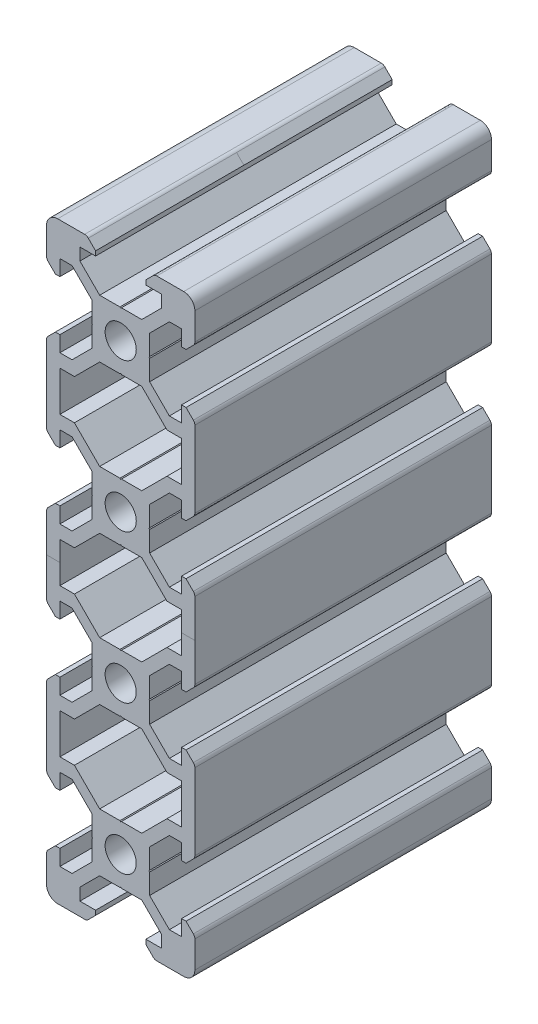
from build123d import *

# Parameters (mm, degrees)
SKETCH1_R           = 2.1
BOSS_EXTRUDE2_DEPTH = 40


with BuildPart() as part:
    # Sketch1 → Boss-Extrude2 (new body)
    with BuildSketch(Plane.XY):
        with BuildLine():
            Line((-8.5, 10), (-4.862792737, 10))
            ThreePointArc((-4.862792737, 10), (-4.598292737, 9.947387679), (-4.374060464, 9.797560464))
            Line((-4.374060464, 9.797560464), (-3.3865, 8.81))
            Line((-3.3865, 8.81), (-3.3865, 8.2))
            Line((-3.3865, 8.2), (-5.5, 8.2))
            Line((-5.5, 8.2), (-5.5, 6.561))
            Line((-5.5, 6.561), (-2.8395, 3.9005))
            Line((-2.8395, 3.9005), (-0.1, 3.9005))
            Line((-0.1, 3.9005), (0, 3.8005))
            Line((0, 3.8005), (0.1, 3.9005))
            Line((0.1, 3.9005), (2.8395, 3.9005))
            Line((2.8395, 3.9005), (5.5, 6.561))
            Line((5.5, 6.561), (5.5, 8.2))
            Line((5.5, 8.2), (3.3865, 8.2))
            Line((3.3865, 8.2), (3.3865, 8.81))
            Line((3.3865, 8.81), (4.374060464, 9.797560464))
            ThreePointArc((4.374060464, 9.797560464), (4.598292737, 9.947387679), (4.862792737, 10))
            Line((4.862792737, 10), (8.5, 10))
            ThreePointArc((8.5, 10), (9.560660172, 9.560660172), (10, 8.5))
            Line((10, 8.5), (10, 4.862792737))
            ThreePointArc((10, 4.862792737), (9.947387679, 4.598292737), (9.797560464, 4.374060464))
            Line((9.797560464, 4.374060464), (8.81, 3.3865))
            Line((8.81, 3.3865), (8.2, 3.3865))
            Line((8.2, 3.3865), (8.2, 5.5))
            Line((8.2, 5.5), (6.561, 5.5))
            Line((6.561, 5.5), (3.9005, 2.8395))
            Line((3.9005, 2.8395), (3.9005, 0.1))
            Line((3.9005, 0.1), (3.8005, 0))
            Line((3.8005, 0), (3.9005, -0.1))
            Line((3.9005, -0.1), (3.9005, -2.8395))
            Line((3.9005, -2.8395), (6.561, -5.5))
            Line((6.561, -5.5), (8.2, -5.5))
            Line((8.2, -5.5), (8.2, -3.3865))
            Line((8.2, -3.3865), (8.81, -3.3865))
            Line((8.81, -3.3865), (9.797560464, -4.374060464))
            ThreePointArc((9.797560464, -4.374060464), (9.947387679, -4.598292737), (10, -4.862792737))
            Line((10, -4.862792737), (10, -15.137207263))
            ThreePointArc((10, -15.137207263), (9.947387679, -15.401707263), (9.797560464, -15.625939536))
            Line((9.797560464, -15.625939536), (8.81, -16.6135))
            Line((8.81, -16.6135), (8.2, -16.6135))
            Line((8.2, -16.6135), (8.2, -14.5))
            Line((8.2, -14.5), (6.561, -14.5))
            Line((6.561, -14.5), (3.9005, -17.1605))
            Line((3.9005, -17.1605), (3.9005, -19.9))
            Line((3.9005, -19.9), (3.8005, -20))
            Line((3.8005, -20), (3.9005, -20.1))
            Line((3.9005, -20.1), (3.9005, -22.8395))
            Line((3.9005, -22.8395), (6.561, -25.5))
            Line((6.561, -25.5), (8.2, -25.5))
            Line((8.2, -25.5), (8.2, -23.3865))
            Line((8.2, -23.3865), (8.81, -23.3865))
            Line((8.81, -23.3865), (9.797560464, -24.374060464))
            ThreePointArc((9.797560464, -24.374060464), (9.947387679, -24.598292737), (10, -24.862792737))
            Line((10, -24.862792737), (10, -35.137207263))
            ThreePointArc((10, -35.137207263), (9.947387679, -35.401707263), (9.797560464, -35.625939536))
            Line((9.797560464, -35.625939536), (8.81, -36.6135))
            Line((8.81, -36.6135), (8.2, -36.6135))
            Line((8.2, -36.6135), (8.2, -34.5))
            Line((8.2, -34.5), (6.561, -34.5))
            Line((6.561, -34.5), (3.9005, -37.1605))
            Line((3.9005, -37.1605), (3.9005, -39.9))
            Line((3.9005, -39.9), (3.8005, -40))
            Line((3.8005, -40), (3.9005, -40.1))
            Line((3.9005, -40.1), (3.9005, -42.8395))
            Line((3.9005, -42.8395), (6.561, -45.5))
            Line((6.561, -45.5), (8.2, -45.5))
            Line((8.2, -45.5), (8.2, -43.3865))
            Line((8.2, -43.3865), (8.81, -43.3865))
            Line((8.81, -43.3865), (9.797560464, -44.374060464))
            ThreePointArc((9.797560464, -44.374060464), (9.947387679, -44.598292737), (10, -44.862792737))
            Line((10, -44.862792737), (10, -55.137207263))
            ThreePointArc((10, -55.137207263), (9.947387679, -55.401707263), (9.797560464, -55.625939536))
            Line((9.797560464, -55.625939536), (8.81, -56.6135))
            Line((8.81, -56.6135), (8.2, -56.6135))
            Line((8.2, -56.6135), (8.2, -54.5))
            Line((8.2, -54.5), (6.561, -54.5))
            Line((6.561, -54.5), (3.9005, -57.1605))
            Line((3.9005, -57.1605), (3.9005, -59.9))
            Line((3.9005, -59.9), (3.8005, -60))
            Line((3.8005, -60), (3.9005, -60.1))
            Line((3.9005, -60.1), (3.9005, -62.8395))
            Line((3.9005, -62.8395), (6.561, -65.5))
            Line((6.561, -65.5), (8.2, -65.5))
            Line((8.2, -65.5), (8.2, -63.3865))
            Line((8.2, -63.3865), (8.81, -63.3865))
            Line((8.81, -63.3865), (9.797560464, -64.374060464))
            ThreePointArc((9.797560464, -64.374060464), (9.947387679, -64.598292737), (10, -64.862792737))
            Line((10, -64.862792737), (10, -68.5))
            ThreePointArc((10, -68.5), (9.560660172, -69.560660172), (8.5, -70))
            Line((8.5, -70), (4.862792737, -70))
            ThreePointArc((4.862792737, -70), (4.598292737, -69.947387679), (4.374060464, -69.797560464))
            Line((4.374060464, -69.797560464), (3.3865, -68.81))
            Line((3.3865, -68.81), (3.3865, -68.2))
            Line((3.3865, -68.2), (5.5, -68.2))
            Line((5.5, -68.2), (5.5, -66.561))
            Line((5.5, -66.561), (2.8395, -63.9005))
            Line((2.8395, -63.9005), (0.1, -63.9005))
            Line((0.1, -63.9005), (0, -63.8005))
            Line((0, -63.8005), (-0.1, -63.9005))
            Line((-0.1, -63.9005), (-2.8395, -63.9005))
            Line((-2.8395, -63.9005), (-5.5, -66.561))
            Line((-5.5, -66.561), (-5.5, -68.2))
            Line((-5.5, -68.2), (-3.3865, -68.2))
            Line((-3.3865, -68.2), (-3.3865, -68.81))
            Line((-3.3865, -68.81), (-4.374060464, -69.797560464))
            ThreePointArc((-4.374060464, -69.797560464), (-4.598292737, -69.947387679), (-4.862792737, -70))
            Line((-4.862792737, -70), (-8.5, -70))
            ThreePointArc((-8.5, -70), (-9.560660172, -69.560660172), (-10, -68.5))
            Line((-10, -68.5), (-10, -64.862792737))
            ThreePointArc((-10, -64.862792737), (-9.947387679, -64.598292737), (-9.797560464, -64.374060464))
            Line((-9.797560464, -64.374060464), (-8.81, -63.3865))
            Line((-8.81, -63.3865), (-8.2, -63.3865))
            Line((-8.2, -63.3865), (-8.2, -65.5))
            Line((-8.2, -65.5), (-6.561, -65.5))
            Line((-6.561, -65.5), (-3.9005, -62.8395))
            Line((-3.9005, -62.8395), (-3.9005, -60.1))
            Line((-3.9005, -60.1), (-3.8005, -60))
            Line((-3.8005, -60), (-3.9005, -59.9))
            Line((-3.9005, -59.9), (-3.9005, -57.1605))
            Line((-3.9005, -57.1605), (-6.561, -54.5))
            Line((-6.561, -54.5), (-8.2, -54.5))
            Line((-8.2, -54.5), (-8.2, -56.6135))
            Line((-8.2, -56.6135), (-8.81, -56.6135))
            Line((-8.81, -56.6135), (-9.797560464, -55.625939536))
            ThreePointArc((-9.797560464, -55.625939536), (-9.947387679, -55.401707263), (-10, -55.137207263))
            Line((-10, -55.137207263), (-10, -44.862792737))
            ThreePointArc((-10, -44.862792737), (-9.947387679, -44.598292737), (-9.797560464, -44.374060464))
            Line((-9.797560464, -44.374060464), (-8.81, -43.3865))
            Line((-8.81, -43.3865), (-8.2, -43.3865))
            Line((-8.2, -43.3865), (-8.2, -45.5))
            Line((-8.2, -45.5), (-6.561, -45.5))
            Line((-6.561, -45.5), (-3.9005, -42.8395))
            Line((-3.9005, -42.8395), (-3.9005, -40.1))
            Line((-3.9005, -40.1), (-3.8005, -40))
            Line((-3.8005, -40), (-3.9005, -39.9))
            Line((-3.9005, -39.9), (-3.9005, -37.1605))
            Line((-3.9005, -37.1605), (-6.561, -34.5))
            Line((-6.561, -34.5), (-8.2, -34.5))
            Line((-8.2, -34.5), (-8.2, -36.6135))
            Line((-8.2, -36.6135), (-8.81, -36.6135))
            Line((-8.81, -36.6135), (-9.797560464, -35.625939536))
            ThreePointArc((-9.797560464, -35.625939536), (-9.947387679, -35.401707263), (-10, -35.137207263))
            Line((-10, -35.137207263), (-10, -24.862792737))
            ThreePointArc((-10, -24.862792737), (-9.947387679, -24.598292737), (-9.797560464, -24.374060464))
            Line((-9.797560464, -24.374060464), (-8.81, -23.3865))
            Line((-8.81, -23.3865), (-8.2, -23.3865))
            Line((-8.2, -23.3865), (-8.2, -25.5))
            Line((-8.2, -25.5), (-6.561, -25.5))
            Line((-6.561, -25.5), (-3.9005, -22.8395))
            Line((-3.9005, -22.8395), (-3.9005, -20.1))
            Line((-3.9005, -20.1), (-3.8005, -20))
            Line((-3.8005, -20), (-3.9005, -19.9))
            Line((-3.9005, -19.9), (-3.9005, -17.1605))
            Line((-3.9005, -17.1605), (-6.561, -14.5))
            Line((-6.561, -14.5), (-8.2, -14.5))
            Line((-8.2, -14.5), (-8.2, -16.6135))
            Line((-8.2, -16.6135), (-8.81, -16.6135))
            Line((-8.81, -16.6135), (-9.797560464, -15.625939536))
            ThreePointArc((-9.797560464, -15.625939536), (-9.947387679, -15.401707263), (-10, -15.137207263))
            Line((-10, -15.137207263), (-10, -4.862792737))
            ThreePointArc((-10, -4.862792737), (-9.947387679, -4.598292737), (-9.797560464, -4.374060464))
            Line((-9.797560464, -4.374060464), (-8.81, -3.3865))
            Line((-8.81, -3.3865), (-8.2, -3.3865))
            Line((-8.2, -3.3865), (-8.2, -5.5))
            Line((-8.2, -5.5), (-6.561, -5.5))
            Line((-6.561, -5.5), (-3.9005, -2.8395))
            Line((-3.9005, -2.8395), (-3.9005, -0.1))
            Line((-3.9005, -0.1), (-3.8005, 0))
            Line((-3.8005, 0), (-3.9005, 0.1))
            Line((-3.9005, 0.1), (-3.9005, 2.8395))
            Line((-3.9005, 2.8395), (-6.561, 5.5))
            Line((-6.561, 5.5), (-8.2, 5.5))
            Line((-8.2, 5.5), (-8.2, 3.3865))
            Line((-8.2, 3.3865), (-8.81, 3.3865))
            Line((-8.81, 3.3865), (-9.797560464, 4.374060464))
            ThreePointArc((-9.797560464, 4.374060464), (-9.947387679, 4.598292737), (-10, 4.862792737))
            Line((-10, 4.862792737), (-10, 8.5))
            ThreePointArc((-10, 8.5), (-9.560660172, 9.560660172), (-8.5, 10))
        make_face()
        Circle(SKETCH1_R, mode=Mode.SUBTRACT)
        with Locations((0, -20)):
            Circle(SKETCH1_R, mode=Mode.SUBTRACT)
        with Locations(Location((0, -40, 0), (0, 0, 180))):
            Circle(SKETCH1_R, mode=Mode.SUBTRACT)
        with Locations(Location((0, -60, 0), (0, 0, 180))):
            Circle(SKETCH1_R, mode=Mode.SUBTRACT)
        Polygon((-8.2, -12.7), (-8.2, -7.3), (-6.239, -7.3), (-5.5, -6.561), (-2.8395, -3.9005), (-0.1, -3.9005), (0, -3.8005), (0.1, -3.9005), (2.8395, -3.9005), (5.5, -6.561), (6.239, -7.3), (8.2, -7.3), (8.2, -12.7), (6.239, -12.7), (5.5, -13.439), (2.8395, -16.0995), (0.1, -16.0995), (0, -16.1995), (-0.1, -16.0995), (-2.8395, -16.0995), (-5.5, -13.439), (-6.239, -12.7), align=None, mode=Mode.SUBTRACT)
        Polygon((2.8395, -23.9005), (5.5, -26.561), (6.239, -27.3), (8.2, -27.3), (8.2, -32.7), (6.239, -32.7), (5.5, -33.439), (2.8395, -36.0995), (0.1, -36.0995), (0, -36.1995), (-0.1, -36.0995), (-2.8395, -36.0995), (-5.5, -33.439), (-6.239, -32.7), (-8.2, -32.7), (-8.2, -27.3), (-6.239, -27.3), (-5.5, -26.561), (-2.8395, -23.9005), (-0.1, -23.9005), (0, -23.8005), (0.1, -23.9005), align=None, mode=Mode.SUBTRACT)
        Polygon((-0.1, -56.0995), (0, -56.1995), (0.1, -56.0995), (2.8395, -56.0995), (5.5, -53.439), (6.239, -52.7), (8.2, -52.7), (8.2, -47.3), (6.239, -47.3), (5.5, -46.561), (2.8395, -43.9005), (0.1, -43.9005), (0, -43.8005), (-0.1, -43.9005), (-2.8395, -43.9005), (-5.5, -46.561), (-6.239, -47.3), (-8.2, -47.3), (-8.2, -52.7), (-6.239, -52.7), (-5.5, -53.439), (-2.8395, -56.0995), align=None, mode=Mode.SUBTRACT)
    extrude(amount=BOSS_EXTRUDE2_DEPTH)


solid = part.part
